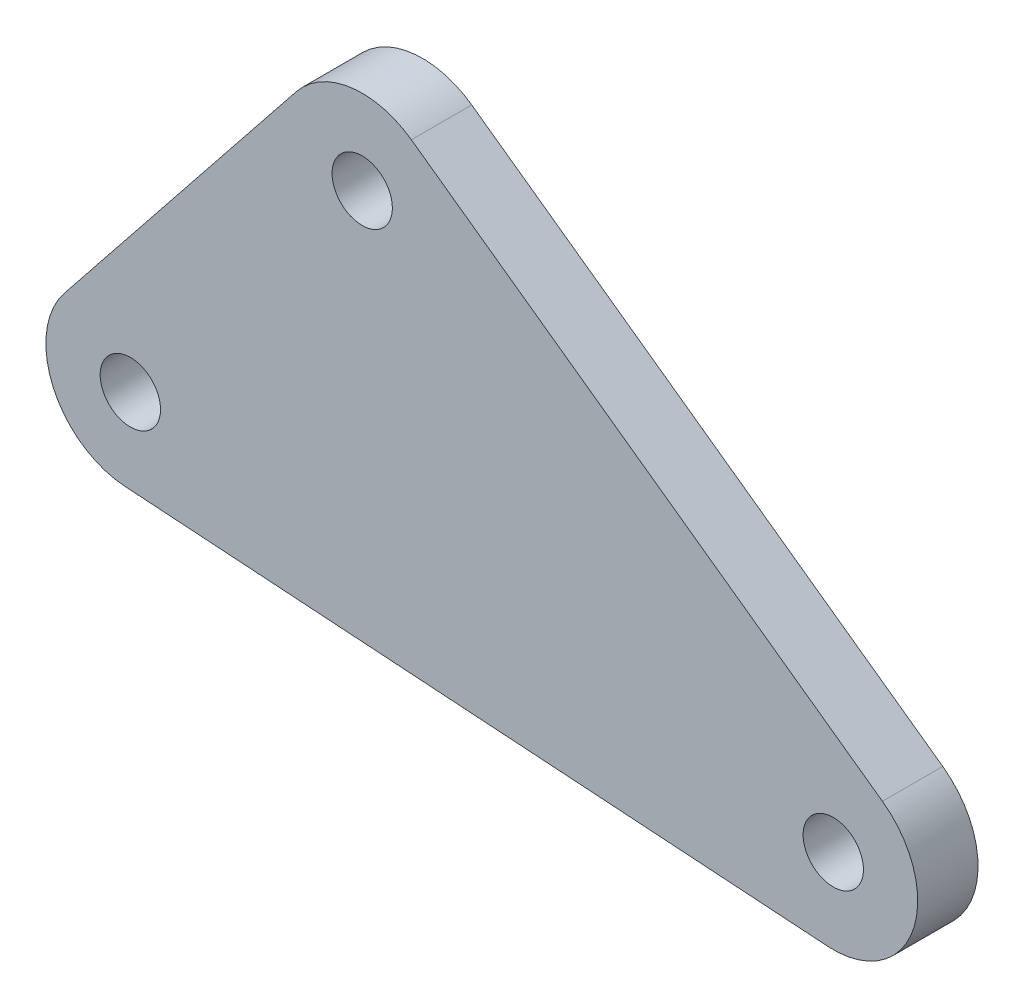
from build123d import *

# Parameters (mm, degrees)
SKETCH1_R           = 3.175
BOSS_EXTRUDE1_DEPTH = 6.35
FILLET1_R           = 8.89


with BuildPart() as part:
    # Sketch1 → Boss-Extrude1 (new body)
    with BuildSketch(Plane.XY):
        Polygon((-17.553118673, -7.738082775), (22.721033398, 42.709495782), (104.544477374, -15.888309799), align=None)
        with Locations((24.404554846, 30.569251852)):
            Circle(SKETCH1_R, mode=Mode.SUBTRACT)
        Circle(SKETCH1_R, mode=Mode.SUBTRACT)
        with Locations((73.986349212, -4.93871757)):
            Circle(SKETCH1_R, mode=Mode.SUBTRACT)
    extrude(amount=BOSS_EXTRUDE1_DEPTH)

    # Fillet1
    fillet1_edges = [part.edges().sort_by_distance(p)[0] for p in [
        (-17.553118673, -7.738082775, 3.175),
        (22.721033398, 42.709495782, 3.175),
        (104.544477374, -15.888309799, 3.175),
    ]]
    fillet(fillet1_edges, radius=FILLET1_R)


solid = part.part
